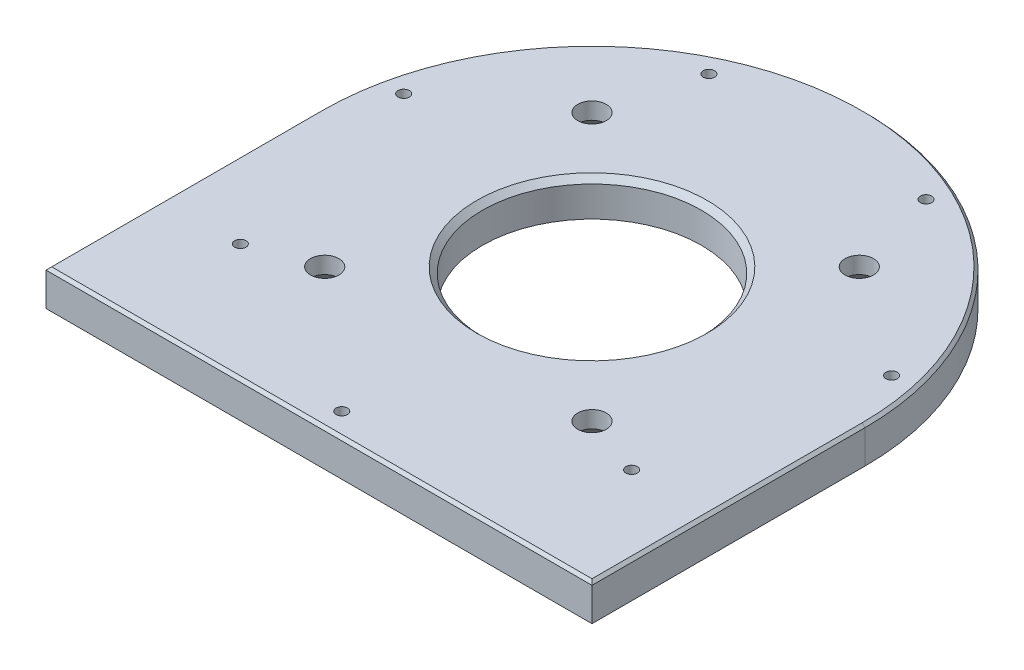
from build123d import *

# Parameters (mm, degrees)
SKETCH6_W           = 96
SKETCH6_H           = 48
BOSS_EXTRUDE1_DEPTH = 6.35
SKETCH2_R           = 48
SKETCH2_R_2         = 1
SKETCH2_R_3         = 19.25
SKETCH2_R_4         = 2.5
BOSS_EXTRUDE2_DEPTH = 6.35
SKETCH2_4_R         = 1
SKETCH2_4_R_2       = 19.25
SKETCH2_4_R_3       = 2.5
CUT_EXTRUDE1_DEPTH  = 6.35
CHAMFER1_SIZE       = 0.5
CHAMFER3_SIZE       = 1
CHAMFER5_SIZE       = 3.4


with BuildPart() as part:
    # Sketch6 → Boss-Extrude1 (new body)
    with BuildSketch(Plane(origin=(0, 0, 0), x_dir=(1, 0, 0), z_dir=(0, 1, 0))):
        with Locations((0, -24)):
            Rectangle(SKETCH6_W, SKETCH6_H)
    extrude(amount=BOSS_EXTRUDE1_DEPTH)

    # Sketch2 → Boss-Extrude2 (add)
    with BuildSketch(Plane(origin=(0, 0, 0), x_dir=(1, 0, 0), z_dir=(0, 1, 0))):
        Circle(SKETCH2_R)
        with Locations((0, -44)):
            Circle(SKETCH2_R_2, mode=Mode.SUBTRACT)
        with Locations((-34.400585229, -27.433551282)):
            Circle(SKETCH2_R_2, mode=Mode.SUBTRACT)
        with Locations((-42.896828136, 9.790921094)):
            Circle(SKETCH2_R_2, mode=Mode.SUBTRACT)
        with Locations((-19.090884521, 39.642630188)):
            Circle(SKETCH2_R_2, mode=Mode.SUBTRACT)
        with Locations((19.090884521, 39.642630188)):
            Circle(SKETCH2_R_2, mode=Mode.SUBTRACT)
        with Locations((42.896828136, 9.790921094)):
            Circle(SKETCH2_R_2, mode=Mode.SUBTRACT)
        with Locations((34.400585229, -27.433551282)):
            Circle(SKETCH2_R_2, mode=Mode.SUBTRACT)
        Circle(SKETCH2_R_3, mode=Mode.SUBTRACT)
        with Locations((23.5, 23.5)):
            Circle(SKETCH2_R_4, mode=Mode.SUBTRACT)
        with Locations((23.5, -23.5)):
            Circle(SKETCH2_R_4, mode=Mode.SUBTRACT)
        with Locations((-23.5, -23.5)):
            Circle(SKETCH2_R_4, mode=Mode.SUBTRACT)
        with Locations((-23.5, 23.5)):
            Circle(SKETCH2_R_4, mode=Mode.SUBTRACT)
    extrude(amount=BOSS_EXTRUDE2_DEPTH)

    # Sketch2<4> → Cut-Extrude1 (cut)
    with BuildSketch(Plane(origin=(0, 0, 0), x_dir=(1, 0, 0), z_dir=(0, 1, 0))):
        with Locations((0, -44)):
            Circle(SKETCH2_4_R)
        with Locations((-34.400585229, -27.433551282)):
            Circle(SKETCH2_4_R)
        with Locations((34.400585229, -27.433551282)):
            Circle(SKETCH2_4_R)
        Circle(SKETCH2_4_R_2)
        with Locations((23.5, -23.5)):
            Circle(SKETCH2_4_R_3)
        with Locations((-23.5, -23.5)):
            Circle(SKETCH2_4_R_3)
    extrude(amount=CUT_EXTRUDE1_DEPTH, mode=Mode.SUBTRACT)

    # Chamfer1
    chamfer1_edges = [part.edges().sort_by_distance(p)[0] for p in [
        (-48, 6.35, 24),
        (0, 6.35, -48),
        (48, 6.35, 24),
        (0, 6.35, 48),
    ]]
    chamfer(chamfer1_edges, length=CHAMFER1_SIZE)

    # Chamfer3
    chamfer3_edges = [part.edges().sort_by_distance(p)[0] for p in [
        (-19.25, 6.35, 0),
    ]]
    chamfer(chamfer3_edges, length=CHAMFER3_SIZE)

    # Chamfer5
    chamfer5_edges = [part.edges().sort_by_distance(p)[0] for p in [
        (21, 0, 23.5),
        (21, 0, -23.5),
        (-26, 0, -23.5),
        (-26, 0, 23.5),
    ]]
    chamfer(chamfer5_edges, length=CHAMFER5_SIZE)


solid = part.part
